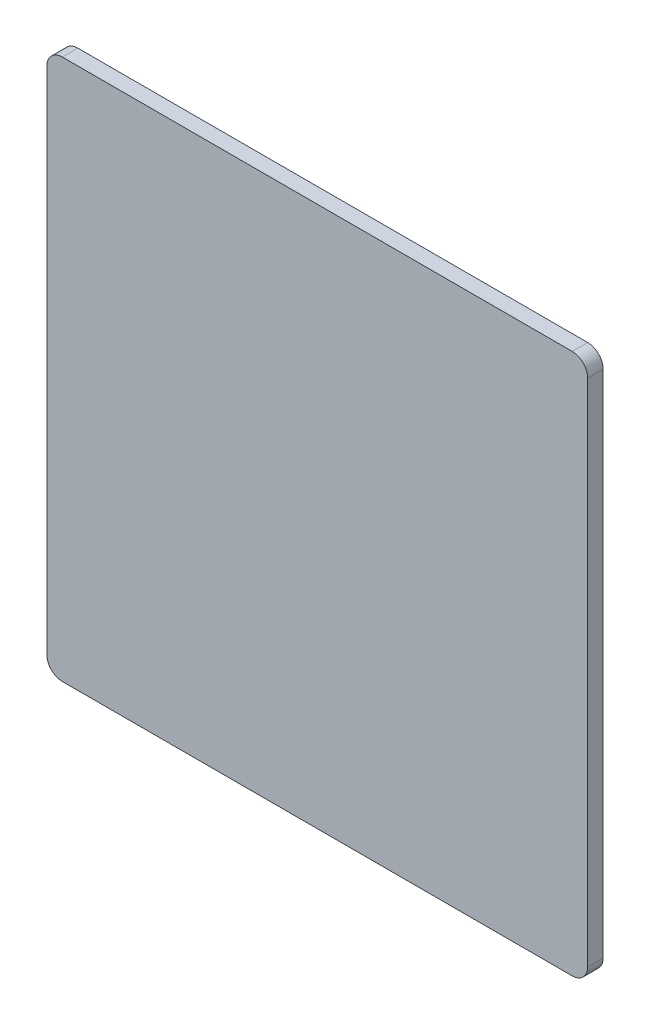
from build123d import *

# Parameters (mm, degrees)
ESQUISSE1_W        = 70
ESQUISSE1_H        = 70
BOSS_EXTRU_1_DEPTH = 2
ESQUISSE3_W        = 14.4
ESQUISSE3_H        = 8.4
ESQUISSE3_W_2      = 10.4
ESQUISSE3_H_2      = 4.4
BOSS_EXTRU_3_DEPTH = 15
D_POUILLE3_ANGLE   = 2
CONG_1_R           = 2


with BuildPart() as part:
    # Esquisse1 → Boss.-Extru.1 (new body)
    with BuildSketch(Plane.XY):
        Rectangle(ESQUISSE1_W, ESQUISSE1_H)
    extrude(amount=BOSS_EXTRU_1_DEPTH)

    # Esquisse3 → Boss.-Extru.3 (add)
    with BuildSketch(Plane.XZ.offset(35)):
        with Locations((0, -2.3)):
            Rectangle(ESQUISSE3_W, ESQUISSE3_H)
        with Locations((0, -2.3)):
            Rectangle(ESQUISSE3_W_2, ESQUISSE3_H_2, mode=Mode.SUBTRACT)
    extrude(amount=-BOSS_EXTRU_3_DEPTH)

    # Dépouille3
    d_pouille3_faces = [part.faces().sort_by_distance(p)[0] for p in [
        (0, -27.5, -0.1),
        (-5.2, -27.5, -2.3),
        (0, -27.5, -4.5),
        (5.2, -27.5, -2.3),
    ]]
    draft(d_pouille3_faces, Plane(origin=(-35, -35, 2), x_dir=(0, 0, -1), z_dir=(0, -1, 0)), D_POUILLE3_ANGLE)

    # Congé1
    cong_1_edges = [part.edges().sort_by_distance(p)[0] for p in [
        (35, -35, 1),
        (-35, -35, 1),
        (-35, 35, 1),
        (35, 35, 1),
    ]]
    fillet(cong_1_edges, radius=CONG_1_R)


solid = part.part
